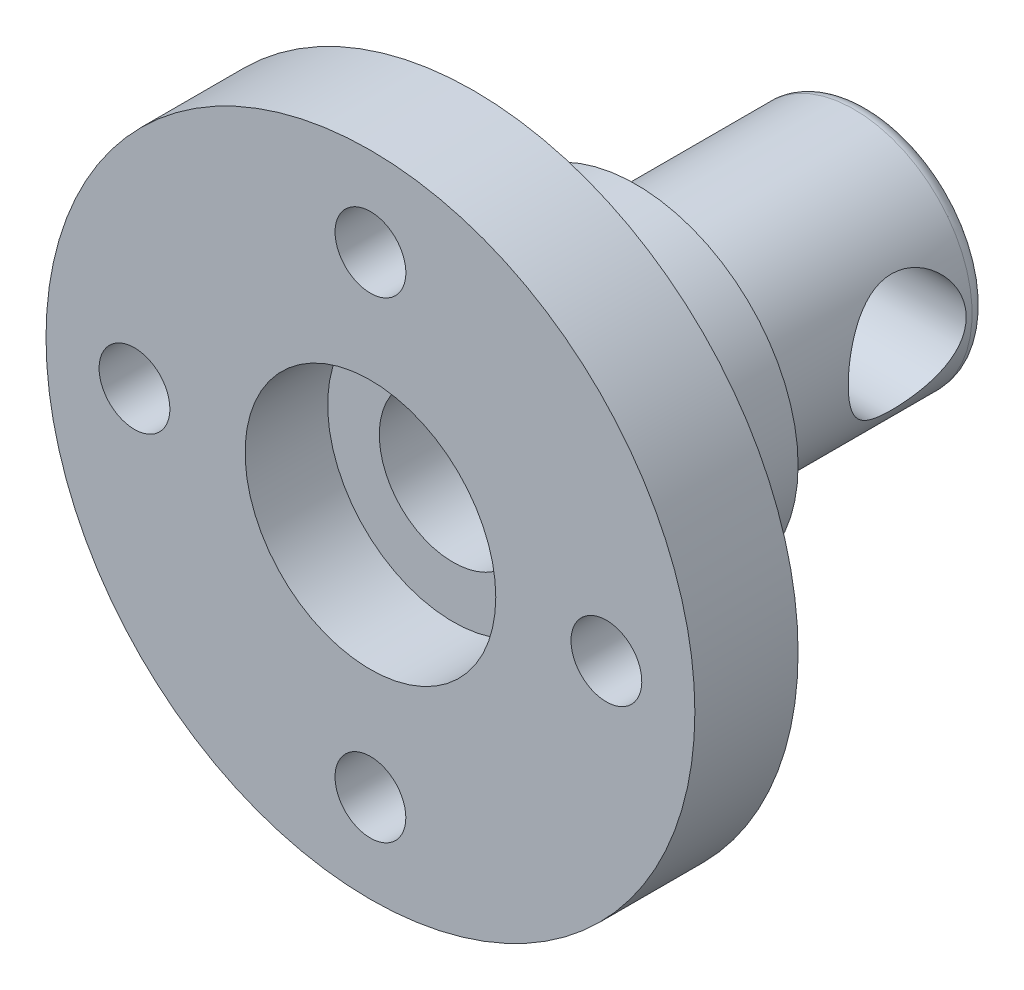
from build123d import *

# Parameters (mm, degrees)
SKETCH_2_R               = 11
EXTRUDE_1_DEPTH          = 3.5
SKETCH_3_R               = 4.25
CUT_EXTRUDE_1_DEPTH      = 2.8
SKETCH_4_R               = 1.2
CUT_EXTRUDE_2_DEPTH      = 16.945218719
PATTERN_CIRCULAR_1_COUNT = 4
SKETCH_6_R               = 4
EXTRUDE_2_DEPTH          = 13.4
CUT_EXTRUDE1_DEPTH       = 21.531926359
CUT_EXTRUDE1_DEPTH_BACK  = 21.531926359
SKETCH1_R                = 2
SKETCH_15_R              = 5.5
EXTRUDE_3_DEPTH          = 5.5
FILLET_1_R               = 0.5
SKETCH_11_R              = 2.5
CUT_EXTRUDE_6_DEPTH      = 2.2


with BuildPart() as part:
    # 草图2 → 凸台-拉伸1 (new body)
    with BuildSketch(Plane.XY):
        Circle(SKETCH_2_R)
    extrude(amount=EXTRUDE_1_DEPTH)

    # 草图3 → 切除-拉伸1 (cut)
    with BuildSketch(Plane.XY.offset(3.5)):
        Circle(SKETCH_3_R)
    extrude(amount=-CUT_EXTRUDE_1_DEPTH, mode=Mode.SUBTRACT)

    # 草图4 → 切除-拉伸2 (cut, through all)
    with BuildSketch(Plane(origin=(0, 0, 0), x_dir=(-1, 0, 0), z_dir=(0, 0, -1))):
        with Locations((0, 8)):
            Circle(SKETCH_4_R)
    cut_extrude_2 = extrude(amount=-CUT_EXTRUDE_2_DEPTH, mode=Mode.SUBTRACT)

    # 阵列(圆周)1: 切除-拉伸2 ×4 about axis
    pattern_circular_1_axis = Axis((0, 0, 0), (0, 0, 1))
    for i in range(1, PATTERN_CIRCULAR_1_COUNT):
        add(cut_extrude_2.rotate(pattern_circular_1_axis, i * 360 / PATTERN_CIRCULAR_1_COUNT), mode=Mode.SUBTRACT)

    # 草图6 → 凸台-拉伸2 (add)
    with BuildSketch(Plane(origin=(0, 0, 0), x_dir=(-1, 0, 0), z_dir=(0, 0, -1))):
        with Locations(Location((0, 0, 0), (0, 0, 180))):
            Circle(SKETCH_6_R)
    extrude(amount=EXTRUDE_2_DEPTH)

    # Sketch1 → Cut-Extrude1 (cut, two sides: drawn at the far end of the back side and taken through both)
    with BuildSketch(Plane(origin=(0, 0, 0), x_dir=(0, 0, -1), z_dir=(1, 0, 0)).offset(-CUT_EXTRUDE1_DEPTH_BACK)):
        with Locations((10.7, 0)):
            Circle(SKETCH1_R)
    extrude(amount=CUT_EXTRUDE1_DEPTH + CUT_EXTRUDE1_DEPTH_BACK, mode=Mode.SUBTRACT)

    # 草图15 → 凸台-拉伸3 (add)
    with BuildSketch(Plane(origin=(0, 0, 0), x_dir=(-1, 0, 0), z_dir=(0, 0, -1))):
        with Locations(Location((0, 0, 0), (0, 0, 180))):
            Circle(SKETCH_15_R)
    extrude(amount=EXTRUDE_3_DEPTH)

    # 圆角1
    fillet_1_edges = [part.edges().sort_by_distance(p)[0] for p in [
        (-4, 0, -13.4),
    ]]
    fillet(fillet_1_edges, radius=FILLET_1_R)

    # 草图11 → 切除-拉伸6 (cut)
    with BuildSketch(Plane.XY.offset(0.7)):
        Circle(SKETCH_11_R)
    extrude(amount=-CUT_EXTRUDE_6_DEPTH, mode=Mode.SUBTRACT)


solid = part.part
